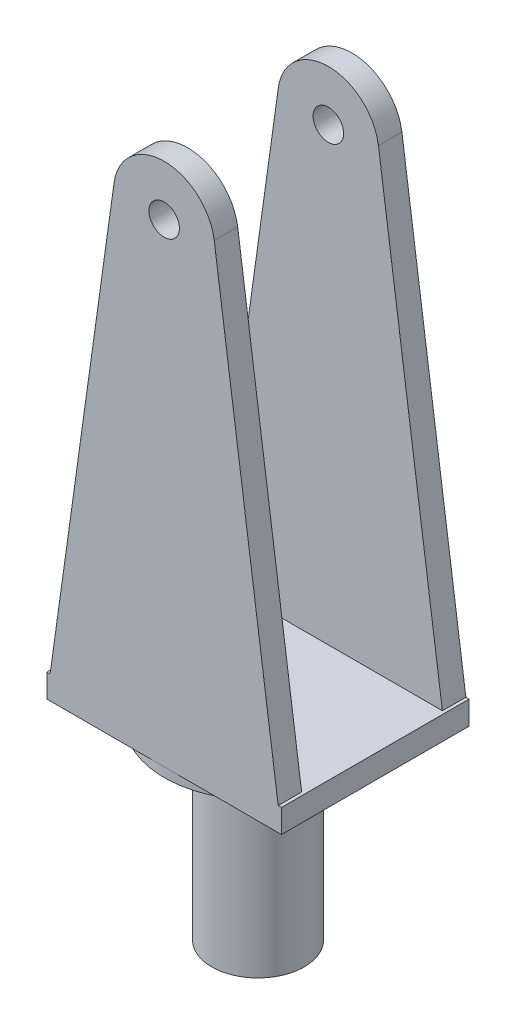
from build123d import *

# Parameters (mm, degrees)
SKETCH1_W           = 25
SKETCH1_H           = 20
BOSS_EXTRUDE1_DEPTH = 2.5
SKETCH4_R           = 10
BOSS_EXTRUDE3_DEPTH = 1
SKETCH5_R           = 4.9365
BOSS_EXTRUDE4_DEPTH = 20
SKETCH6_R           = 1.627
BOSS_EXTRUDE5_DEPTH = 2.5


with BuildPart() as part:
    # Sketch1 → Boss-Extrude1 (new body)
    with BuildSketch(Plane(origin=(0, 0, 0), x_dir=(1, 0, 0), z_dir=(0, 1, 0))):
        Rectangle(SKETCH1_W, SKETCH1_H)
    extrude(amount=BOSS_EXTRUDE1_DEPTH)

    # Sketch4 → Boss-Extrude3 (add)
    with BuildSketch(Plane.XZ):
        with Locations(Location((0, 0, 0), (0, 0, 270))):
            Circle(SKETCH4_R)
    extrude(amount=BOSS_EXTRUDE3_DEPTH)

    # Sketch5 → Boss-Extrude4 (add)
    with BuildSketch(Plane.XZ.offset(1)):
        with Locations(Location((0, 0, 0), (0, 0, 270))):
            Circle(SKETCH5_R)
    extrude(amount=BOSS_EXTRUDE4_DEPTH)

    # Sketch6 → Boss-Extrude5 (add)
    with BuildSketch(Plane(origin=(0, 0, -10), x_dir=(-1, 0, 0), z_dir=(0, 0, -1))):
        with BuildLine():
            Line((-12.150452519, 2.5), (12.150452519, 2.5))
            Line((12.150452519, 2.5), (5.334920531, 51.245394823))
            ThreePointArc((5.334920531, 51.245394823), (0, 55.886742106), (-5.334920531, 51.245394823))
            Line((-5.334920531, 51.245394823), (-12.150452519, 2.5))
        make_face()
        with Locations((0, 50.5)):
            Circle(SKETCH6_R, mode=Mode.SUBTRACT)
    boss_extrude5 = extrude(amount=-BOSS_EXTRUDE5_DEPTH)

    # Mirror2: Boss-Extrude5 across plane
    add(boss_extrude5.mirror(Plane(origin=(0, 0, 0), x_dir=(1, 0, 0), z_dir=(0, 0, -1))))


solid = part.part
